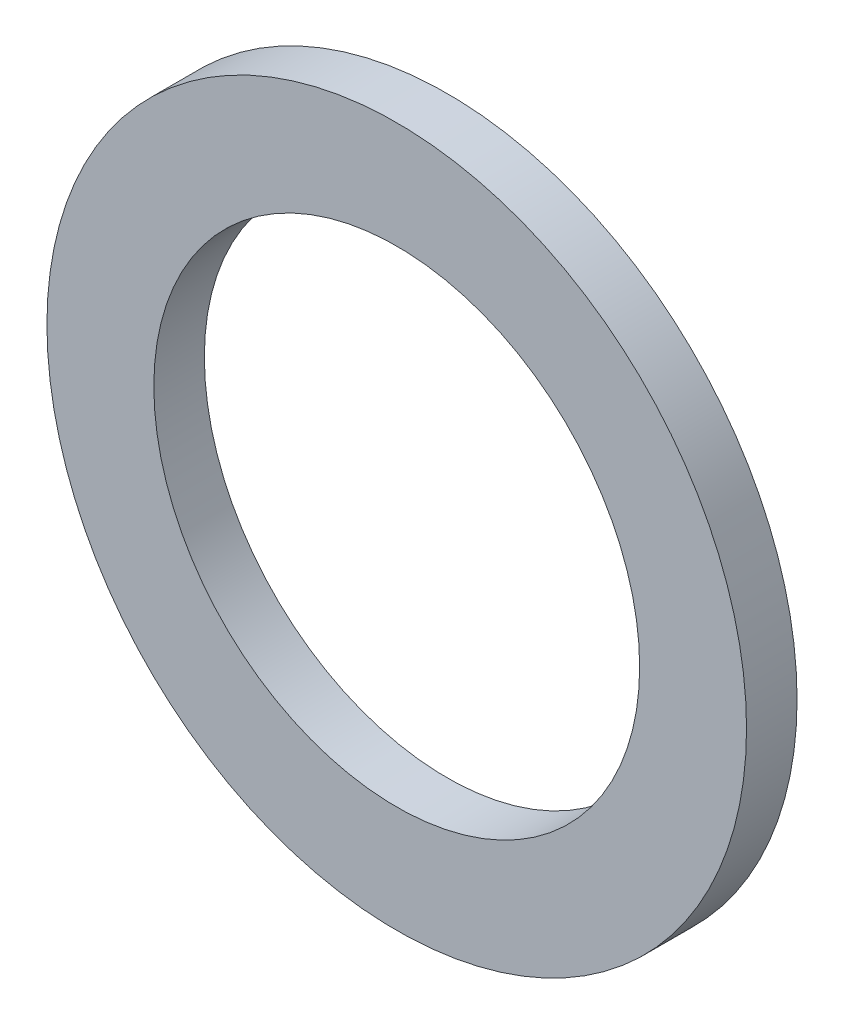
from build123d import *

# Parameters (mm, degrees)
SKETCH_1_R      = 9
SKETCH_1_R_2    = 6.25
EXTRUDE_1_DEPTH = 1.3


with BuildPart() as part:
    # Эскиз1 → Бобышка-Вытянуть1 (new body)
    with BuildSketch(Plane.XY):
        Circle(SKETCH_1_R)
        Circle(SKETCH_1_R_2, mode=Mode.SUBTRACT)
    extrude(amount=EXTRUDE_1_DEPTH)


solid = part.part
